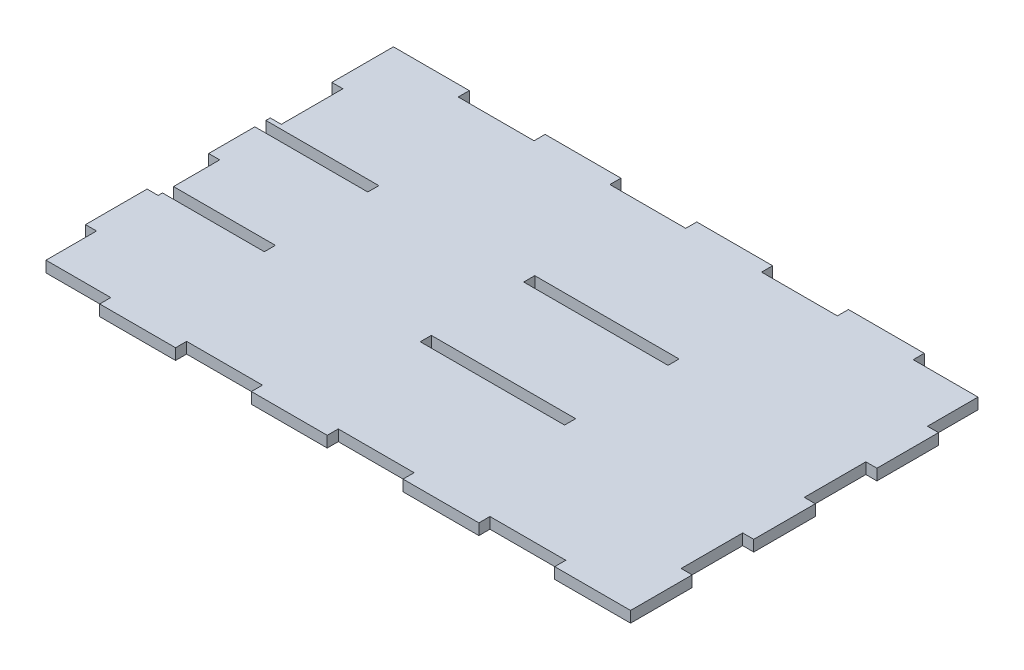
from build123d import *

# Parameters (mm, degrees)
SKETCH1_W           = 59.517928736
SKETCH1_H           = 4.5593
BOSS_EXTRUDE1_DEPTH = 4.5593


with BuildPart() as part:
    # Sketch1 → Boss-Extrude1 (new body)
    with BuildSketch(Plane(origin=(0, 0, 0), x_dir=(1, 0, 0), z_dir=(0, 1, 0))):
        Polygon((-100.66298534, 77.9907), (-131.93673534, 77.9907), (-131.93673534, 52.5907), (-127.37743534, 52.5907), (-127.37743534, 27.1907), (-131.93673534, 27.1907), (-131.93673534, 25.4), (-85.368575998, 25.4), (-85.368575998, 20.8407), (-131.93673534, 20.8407), (-131.93673534, 1.7907), (-127.37743534, 1.7907), (-127.37743534, -17.2593), (-85.368575998, -17.2593), (-85.368575998, -21.8186), (-127.37743534, -21.8186), (-127.37743534, -23.6093), (-131.93673534, -23.6093), (-131.93673534, -49.0093), (-127.37743534, -49.0093), (-127.37743534, -69.85), (-100.66298534, -69.85), (-100.66298534, -74.4093), (-69.38923534, -74.4093), (-69.38923534, -69.85), (-38.11548534, -69.85), (-38.11548534, -74.4093), (-6.84173534, -74.4093), (-6.84173534, -69.85), (24.43201466, -69.85), (24.43201466, -74.4093), (55.70576466, -74.4093), (55.70576466, -69.85), (86.97951466, -69.85), (86.97951466, -74.4093), (118.25326466, -74.4093), (118.25326466, -49.0093), (113.69396466, -49.0093), (113.69396466, -23.6093), (118.25326466, -23.6093), (118.25326466, 1.7907), (113.69396466, 1.7907), (113.69396466, 27.1907), (118.25326466, 27.1907), (118.25326466, 52.5907), (113.69396466, 52.5907), (113.69396466, 73.4314), (86.97951466, 73.4314), (86.97951466, 77.9907), (55.70576466, 77.9907), (55.70576466, 73.4314), (24.43201466, 73.4314), (24.43201466, 77.9907), (-6.84173534, 77.9907), (-6.84173534, 73.4314), (-38.11548534, 73.4314), (-38.11548534, 77.9907), (-69.38923534, 77.9907), (-69.38923534, 73.4314), (-100.66298534, 73.4314), align=None)
        with Locations((8.690322735, -19.53895)):
            Rectangle(SKETCH1_W, SKETCH1_H, mode=Mode.SUBTRACT)
        with Locations((8.690322735, 23.12035)):
            Rectangle(SKETCH1_W, SKETCH1_H, mode=Mode.SUBTRACT)
    extrude(amount=BOSS_EXTRUDE1_DEPTH)


solid = part.part
